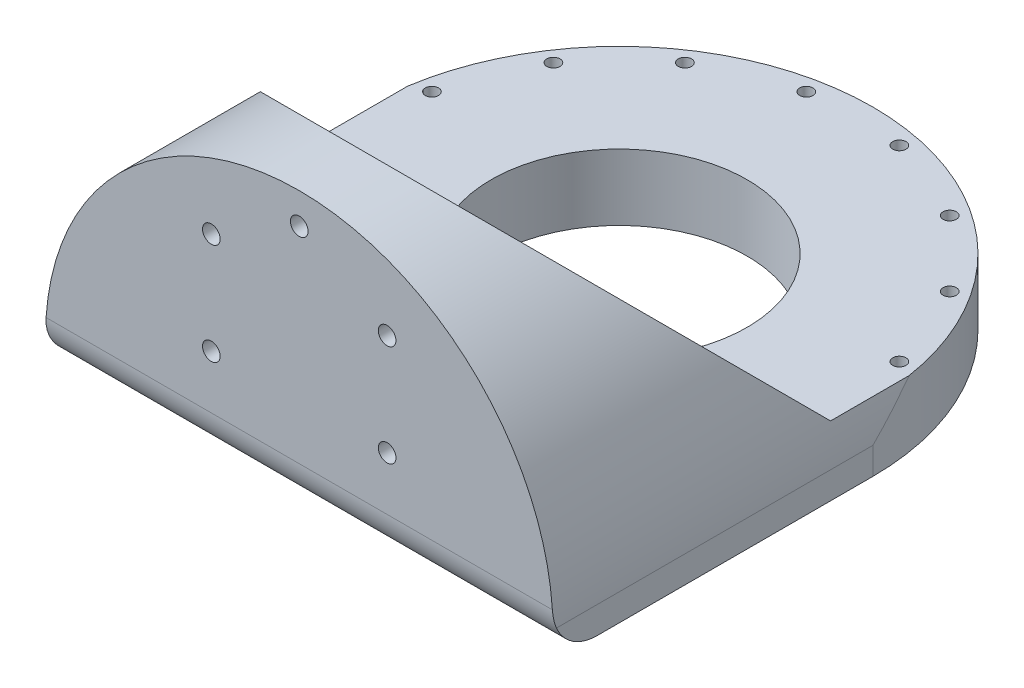
from build123d import *

# Parameters (mm, degrees)
SKETCH1_R           = 57.5
SKETCH1_R_2         = 1.5
SKETCH1_R_3         = 29
BOSS_EXTRUDE1_DEPTH = 15
BOSS_EXTRUDE2_DEPTH = 115
CUT_EXTRUDE1_START  = -48.6
SKETCH3_R           = 57.5
CUT_EXTRUDE1_DEPTH  = 48.6
SKETCH5_R           = 2
CUT_EXTRUDE3_DEPTH  = 75.6
SKETCH6_R           = 4.25
CUT_EXTRUDE4_DEPTH  = 62.5
CUT_EXTRUDE2_DEPTH  = 132.6
FILLET1_R           = 10


with BuildPart() as part:
    # Sketch1 → Boss-Extrude1 (new body)
    # profile 1 of 3: a face of its own
    with BuildSketch(Plane(origin=(0, 0, 0), x_dir=(1, 0, 0), z_dir=(0, 1, 0))):
        Circle(SKETCH1_R)
        with Locations(Location((-30.000792583, 44.899359064, 0), (0, 0, 270))):
            Circle(SKETCH1_R_2, mode=Mode.SUBTRACT)
        with Locations(Location((-44.899359064, 30.000792583, 0), (0, 0, 270))):
            Circle(SKETCH1_R_2, mode=Mode.SUBTRACT)
        with Locations(Location((-52.962405142, 10.534877389, 0), (0, 0, 270))):
            Circle(SKETCH1_R_2, mode=Mode.SUBTRACT)
        with Locations(Location((-52.962405142, -10.534877389, 0), (0, 0, 270))):
            Circle(SKETCH1_R_2, mode=Mode.SUBTRACT)
        with Locations(Location((-44.899359064, -30.000792583, 0), (0, 0, 270))):
            Circle(SKETCH1_R_2, mode=Mode.SUBTRACT)
        with Locations(Location((-30.000792583, -44.899359064, 0), (0, 0, 270))):
            Circle(SKETCH1_R_2, mode=Mode.SUBTRACT)
        with Locations(Location((-10.534877389, -52.962405142, 0), (0, 0, 270))):
            Circle(SKETCH1_R_2, mode=Mode.SUBTRACT)
        with Locations(Location((10.534877389, -52.962405142, 0), (0, 0, 270))):
            Circle(SKETCH1_R_2, mode=Mode.SUBTRACT)
        with Locations(Location((30.000792583, -44.899359064, 0), (0, 0, 270))):
            Circle(SKETCH1_R_2, mode=Mode.SUBTRACT)
        with Locations(Location((44.899359064, -30.000792583, 0), (0, 0, 270))):
            Circle(SKETCH1_R_2, mode=Mode.SUBTRACT)
        with Locations(Location((52.962405142, -10.534877389, 0), (0, 0, 270))):
            Circle(SKETCH1_R_2, mode=Mode.SUBTRACT)
        with Locations(Location((52.962405142, 10.534877389, 0), (0, 0, 270))):
            Circle(SKETCH1_R_2, mode=Mode.SUBTRACT)
        with Locations(Location((44.899359064, 30.000792583, 0), (0, 0, 270))):
            Circle(SKETCH1_R_2, mode=Mode.SUBTRACT)
        with Locations(Location((30.000792583, 44.899359064, 0), (0, 0, 270))):
            Circle(SKETCH1_R_2, mode=Mode.SUBTRACT)
        with Locations(Location((10.534877389, 52.962405142, 0), (0, 0, 270))):
            Circle(SKETCH1_R_2, mode=Mode.SUBTRACT)
        with Locations(Location((-10.534877389, 52.962405142, 0), (0, 0, 270))):
            Circle(SKETCH1_R_2, mode=Mode.SUBTRACT)
        with Locations(Location((0, 0, 0), (0, 0, 270))):
            Circle(SKETCH1_R_3, mode=Mode.SUBTRACT)
    # profile 2 of 3: a face of its own
    with BuildSketch(Plane(origin=(0, 0, 0), x_dir=(1, 0, 0), z_dir=(0, 1, 0))):
        with BuildLine():
            ThreePointArc((2.7e-08, -57.5), (-40.658639909, -40.658639928), (-57.5, 0))
            Line((-57.5, 0), (-57.5, -57.5))
            Line((-57.5, -57.5), (2.7e-08, -57.5))
        make_face()
    # profile 3 of 3: a face of its own
    with BuildSketch(Plane(origin=(0, 0, 0), x_dir=(1, 0, 0), z_dir=(0, 1, 0))):
        with BuildLine():
            Line((57.5, -57.5), (57.5, 0))
            ThreePointArc((57.5, 0), (40.658639928, -40.658639909), (2.7e-08, -57.5))
            Line((2.7e-08, -57.5), (57.5, -57.5))
        make_face()
    extrude(amount=BOSS_EXTRUDE1_DEPTH)

    # Sketch2 → Boss-Extrude2 (add)
    with BuildSketch(Plane.ZY.offset(57.5)):
        Polygon((57.5, 15), (57.5, 0), (72.5, 0), (72.5, 63.6), (57.5, 63.6), align=None)
        Polygon((0, 15), (57.5, 15), (57.5, 63.6), align=None)
    extrude(amount=-BOSS_EXTRUDE2_DEPTH)

    # Sketch3 → Cut-Extrude1 (cut)
    with BuildSketch(Plane(origin=(0, 63.6, 0), x_dir=(1, 0, 0), z_dir=(0, 1, 0)).offset(CUT_EXTRUDE1_START)):
        Circle(SKETCH3_R)
    extrude(amount=CUT_EXTRUDE1_DEPTH, mode=Mode.SUBTRACT)

    # Sketch5 → Cut-Extrude3 (cut)
    with BuildSketch(Plane.XY.offset(72.5)):
        with Locations((0, 56.6)):
            Circle(SKETCH5_R)
        with Locations((-19.918584287, 45.1)):
            Circle(SKETCH5_R)
        with Locations((-19.918584287, 22.1)):
            Circle(SKETCH5_R)
        with Locations((19.918584287, 22.1)):
            Circle(SKETCH5_R)
        with Locations((19.918584287, 45.1)):
            Circle(SKETCH5_R)
    extrude(amount=-CUT_EXTRUDE3_DEPTH, mode=Mode.SUBTRACT)

    # Sketch6 → Cut-Extrude4 (cut)
    with BuildSketch(Plane.XY):
        with Locations(Location((0, 56.6, 0), (0, 0, 270))):
            Circle(SKETCH6_R)
        with Locations(Location((19.918584287, 45.1, 0), (0, 0, 180))):
            Circle(SKETCH6_R)
        with Locations(Location((19.918584287, 22.1, 0), (0, 0, 180))):
            Circle(SKETCH6_R)
        with Locations(Location((-19.918584287, 22.1, 0), (0, 0, 180))):
            Circle(SKETCH6_R)
        with Locations(Location((-19.918584287, 45.1, 0), (0, 0, 180))):
            Circle(SKETCH6_R)
    extrude(amount=CUT_EXTRUDE4_DEPTH, mode=Mode.SUBTRACT)

    # Sketch4 → Cut-Extrude2 (cut)
    with BuildSketch(Plane.XY.offset(72.5)):
        with BuildLine():
            Line((-57.5, 63.6), (-57.5, 6.099999962))
            ThreePointArc((-57.5, 6.099999962), (-40.658639932, 46.758639905), (0, 63.6))
            Line((0, 63.6), (-57.5, 63.6))
        make_face()
        with BuildLine():
            Line((57.5, 63.6), (0, 63.6))
            ThreePointArc((0, 63.6), (40.658639918, 46.758639918), (57.5, 6.1))
            Line((57.5, 6.1), (57.5, 63.6))
        make_face()
    extrude(amount=-CUT_EXTRUDE2_DEPTH, mode=Mode.SUBTRACT)

    # Fillet1
    fillet1_edges = [part.edges().sort_by_distance(p)[0] for p in [
        (0, 0, 72.5),
    ]]
    fillet(fillet1_edges, radius=FILLET1_R)


solid = part.part
